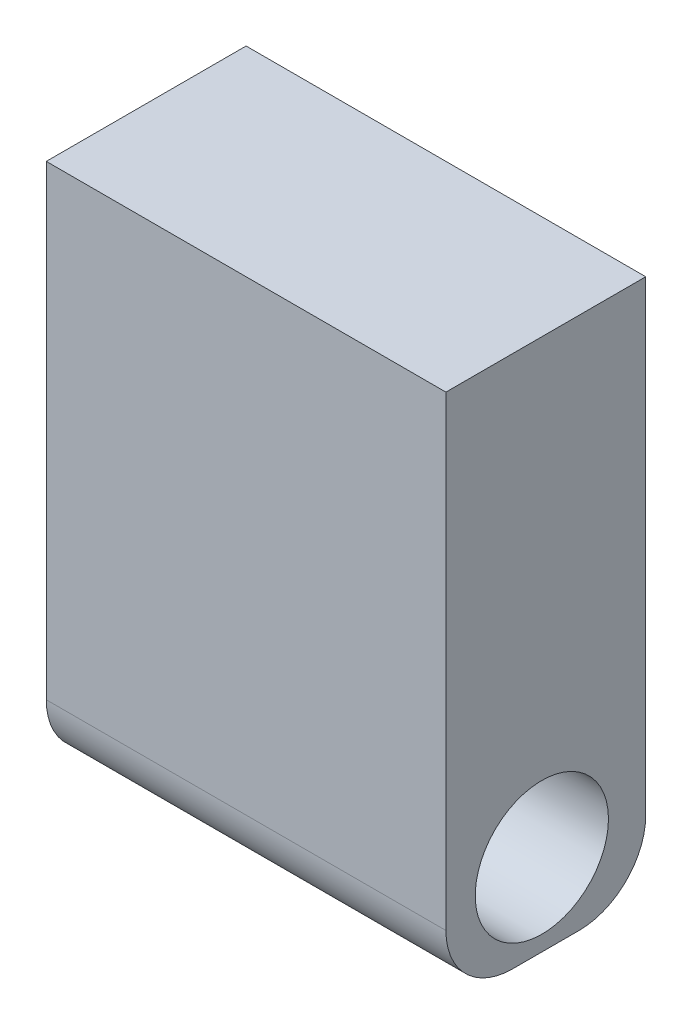
from build123d import *

# Parameters (mm, degrees)
SKETCH1_W           = 30
SKETCH1_H           = 40
BOSS_EXTRUDE2_DEPTH = 15
FILLET4_R           = 5
FILLET5_R           = 5
SKETCH3_R           = 5
CUT_EXTRUDE2_DEPTH  = 53.201532545


with BuildPart() as part:
    # Sketch1 → Boss-Extrude2 (new body)
    with BuildSketch(Plane.XY):
        with Locations((271.793252061, 20)):
            Rectangle(SKETCH1_W, SKETCH1_H)
    extrude(amount=BOSS_EXTRUDE2_DEPTH)

    # Fillet4
    fillet4_edges = [part.edges().sort_by_distance(p)[0] for p in [
        (271.793252061, 0, 15),
    ]]
    fillet(fillet4_edges, radius=FILLET4_R)

    # Fillet5
    fillet5_edges = [part.edges().sort_by_distance(p)[0] for p in [
        (271.793252061, 0, 0),
    ]]
    fillet(fillet5_edges, radius=FILLET5_R)

    # Sketch3 → Cut-Extrude2 (cut, through all)
    with BuildSketch(Plane(origin=(286.793252061, 0, 0), x_dir=(0, 0, -1), z_dir=(1, 0, 0))):
        with Locations((-7.798550368, 6.154011522)):
            Circle(SKETCH3_R)
    extrude(amount=-CUT_EXTRUDE2_DEPTH, mode=Mode.SUBTRACT)


solid = part.part
